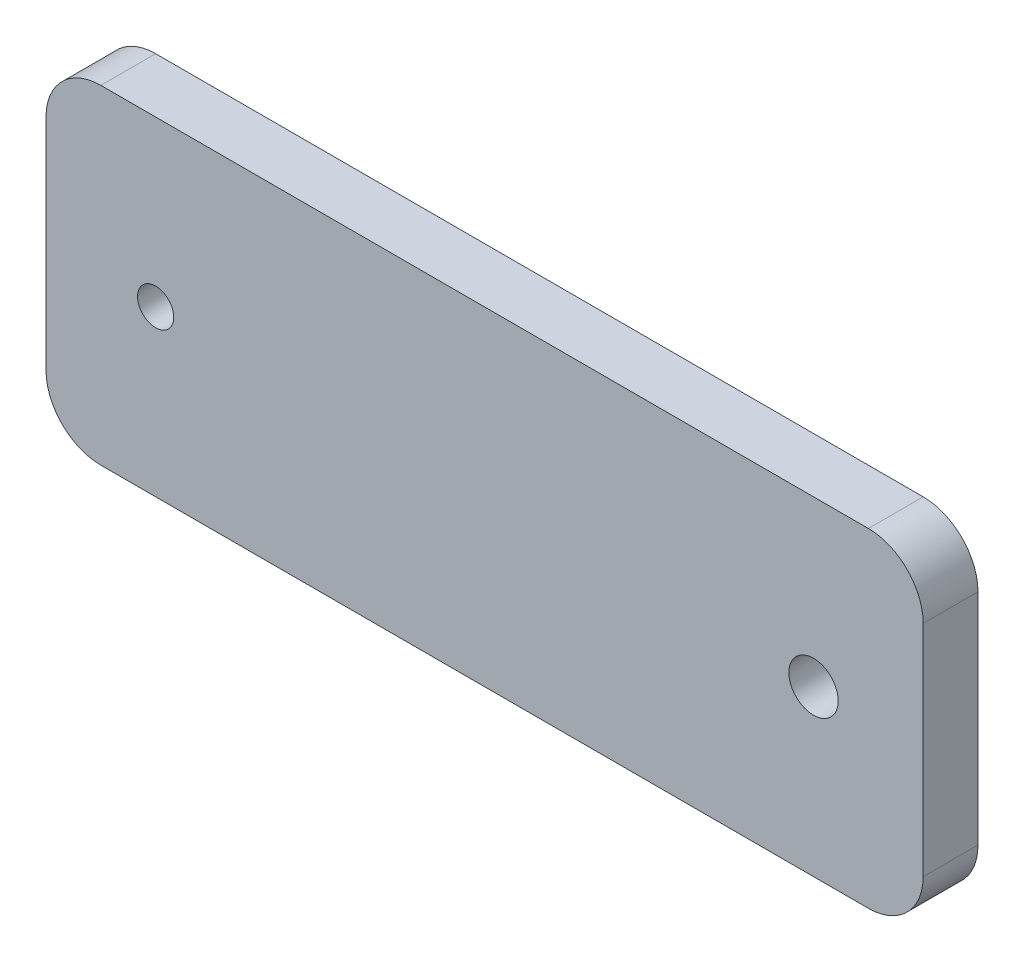
from build123d import *

# Parameters (mm, degrees)
ESQUISSE1_R        = 2.25
BOSS_EXTRU_1_DEPTH = 5
TROU_TARAUD_M41_D  = 3.3


with BuildPart() as part:
    # Esquisse1 → Boss.-Extru.1 (new body)
    with BuildSketch(Plane.XY):
        with BuildLine():
            Line((-35, 15), (35, 15))
            ThreePointArc((35, 15), (38.535533906, 13.535533906), (40, 10))
            Line((40, 10), (40, -10))
            ThreePointArc((40, -10), (38.535533906, -13.535533906), (35, -15))
            Line((35, -15), (-35, -15))
            ThreePointArc((-35, -15), (-38.535533906, -13.535533906), (-40, -10))
            Line((-40, -10), (-40, 10))
            ThreePointArc((-40, 10), (-38.535533906, 13.535533906), (-35, 15))
        make_face()
        with Locations((30, 0)):
            Circle(ESQUISSE1_R, mode=Mode.SUBTRACT)
    extrude(amount=BOSS_EXTRU_1_DEPTH)

    # Trou taraudé M41 (through all)
    with Locations(Plane.XY.offset(5)):
        with Locations((-30, 0)):
            Hole(TROU_TARAUD_M41_D / 2)


solid = part.part
